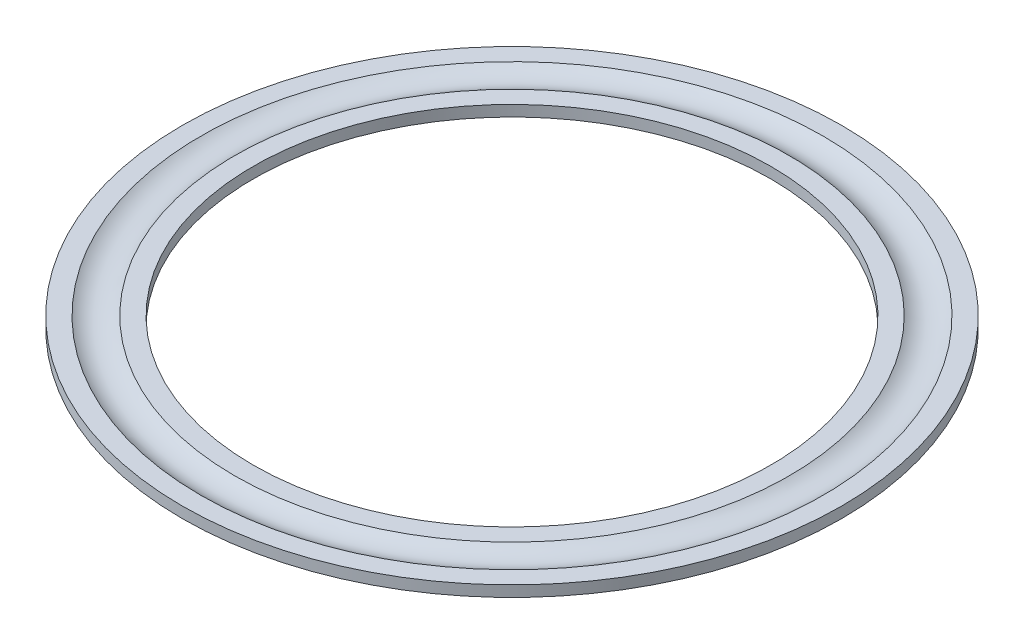
from build123d import *


with BuildPart() as part:
    # Sketch1 → Revolve1 (revolve)
    with BuildSketch(Plane(origin=(0, 0, 0), x_dir=(-1, 0, 0), z_dir=(0, 0, -1)), mode=Mode.PRIVATE) as revolve1_sk:
        with BuildLine():
            Line((-60.4, 0), (-47.4086, 0))
            Line((-47.4086, 0), (-47.4086, 2))
            Line((-47.4086, 2), (-50.8086, 2))
            ThreePointArc((-50.8086, 2), (-53.9043, 0.9681), (-57, 2))
            Line((-57, 2), (-60.4, 2))
            Line((-60.4, 2), (-60.4, 0))
        make_face()
    revolve(revolve1_sk.sketch.rotate(Axis((0, 0, 0), (0, 1, 0)), 270), axis=Axis((0, 0, 0), (0, 1, 0)))


solid = part.part
